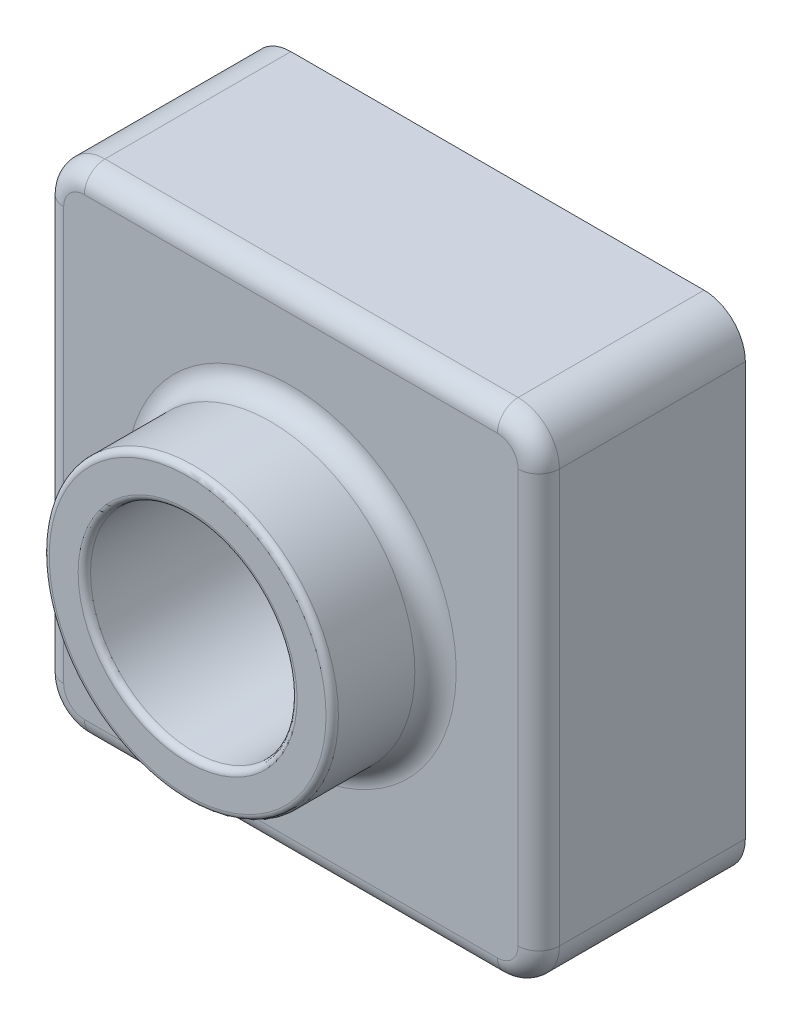
from build123d import *

# Parameters (mm, degrees)
SKETCH1_W           = 120
SKETCH1_H           = 120
BOSS_EXTRUDE2_DEPTH = 50
SKETCH2_R           = 35
BOSS_EXTRUDE3_DEPTH = 25
SKETCH3_R           = 25
CUT_EXTRUDE1_DEPTH  = 186.539753153
FILLET1_R           = 10
FILLET2_R           = 1.5
FILLET3_R           = 5
SHELL1_T            = -2


with BuildPart() as part:
    # Sketch1 → Boss-Extrude2 (new body)
    with BuildSketch(Plane.XY):
        with Locations((60, 60)):
            Rectangle(SKETCH1_W, SKETCH1_H)
    extrude(amount=BOSS_EXTRUDE2_DEPTH)

    # Sketch2 → Boss-Extrude3 (add)
    with BuildSketch(Plane.XY.offset(50)):
        with Locations((60, 60)):
            Circle(SKETCH2_R)
    extrude(amount=BOSS_EXTRUDE3_DEPTH)

    # Sketch3 → Cut-Extrude1 (cut, through all)
    with BuildSketch(Plane.XY.offset(75)):
        with Locations((60, 60)):
            Circle(SKETCH3_R)
    extrude(amount=-CUT_EXTRUDE1_DEPTH, mode=Mode.SUBTRACT)

    # Fillet1
    fillet1_edges = [part.edges().sort_by_distance(p)[0] for p in [
        (0, 0, 25),
        (120, 0, 25),
        (120, 120, 25),
        (0, 120, 25),
    ]]
    fillet(fillet1_edges, radius=FILLET1_R)

    # Fillet2
    fillet2_edges = [part.edges().sort_by_distance(p)[0] for p in [
        (25, 60, 75),
        (35, 60, 75),
    ]]
    fillet(fillet2_edges, radius=FILLET2_R)

    # Fillet3
    fillet3_edges = [part.edges().sort_by_distance(p)[0] for p in [
        (25, 60, 50),
        (60, 0, 50),
        (0, 60, 50),
        (120, 60, 50),
        (60, 120, 50),
        (117.071067812, 117.071067812, 50),
        (117.071067812, 2.928932188, 50),
        (2.928932188, 117.071067812, 50),
        (2.928932188, 2.928932188, 50),
    ]]
    fillet(fillet3_edges, radius=FILLET3_R)

    # Shell1
    shell1_openings = [part.faces().sort_by_distance(p)[0] for p in [
        (60, 1.697056275, 0),
    ]]
    offset(amount=SHELL1_T, openings=shell1_openings, kind=Kind.INTERSECTION)


solid = part.part
